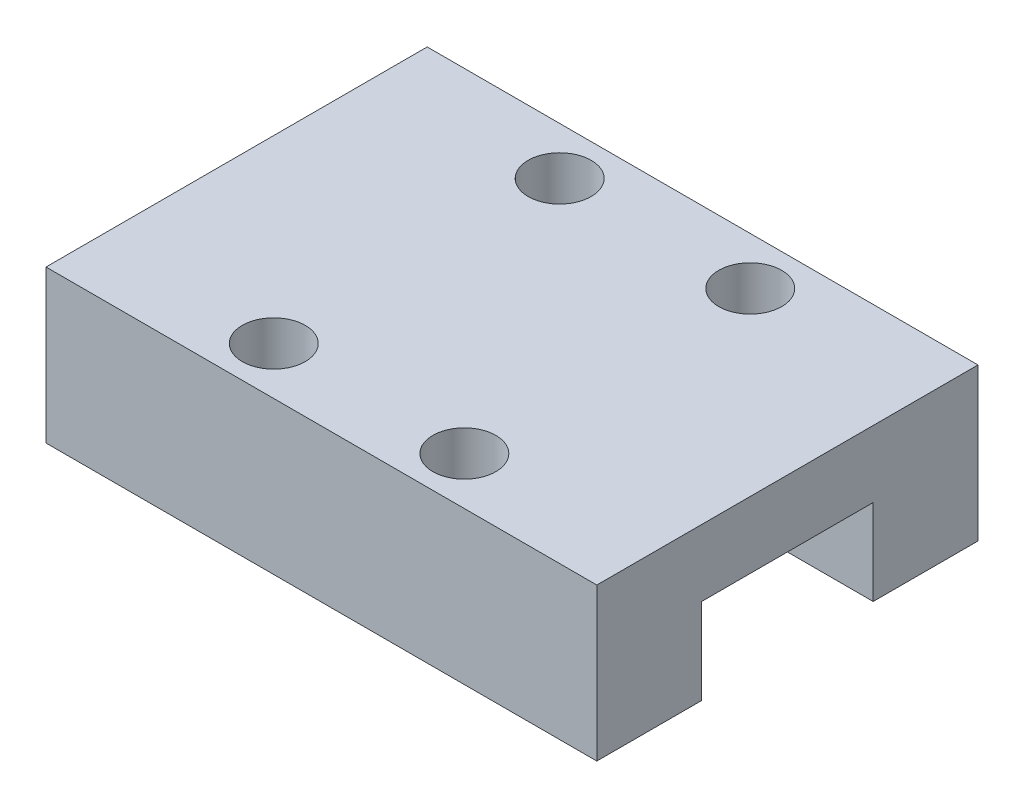
from build123d import *

# Parameters (mm, degrees)
BOSS_EXTRUDE1_DEPTH = 14.45
SKETCH2_R           = 1.651
CUT_EXTRUDE1_DEPTH  = 6.35


with BuildPart() as part:
    # Sketch1 → Boss-Extrude1 (new, symmetric)
    with BuildSketch(Plane(origin=(0, 0, 0), x_dir=(0, 0, -1), z_dir=(1, 0, 0))):
        Polygon((0, 0), (10, 0), (10, -8), (4.5, -8), (4.5, -3.5), (-4.5, -3.5), (-4.5, -8), (-10, -8), (-10, 0), align=None)
    extrude(amount=BOSS_EXTRUDE1_DEPTH, both=True)

    # Sketch2 → Cut-Extrude1 (cut)
    with BuildSketch(Plane(origin=(0, 0, 0), x_dir=(1, 0, 0), z_dir=(0, 1, 0))):
        with Locations(Location((5, 7.5, 0), (0, 0, 270))):
            Circle(SKETCH2_R)
        with Locations(Location((5, -7.5, 0), (0, 0, 270))):
            Circle(SKETCH2_R)
        with Locations(Location((-5, -7.5, 0), (0, 0, 270))):
            Circle(SKETCH2_R)
        with Locations(Location((-5, 7.5, 0), (0, 0, 270))):
            Circle(SKETCH2_R)
    extrude(amount=-CUT_EXTRUDE1_DEPTH, mode=Mode.SUBTRACT)


solid = part.part
